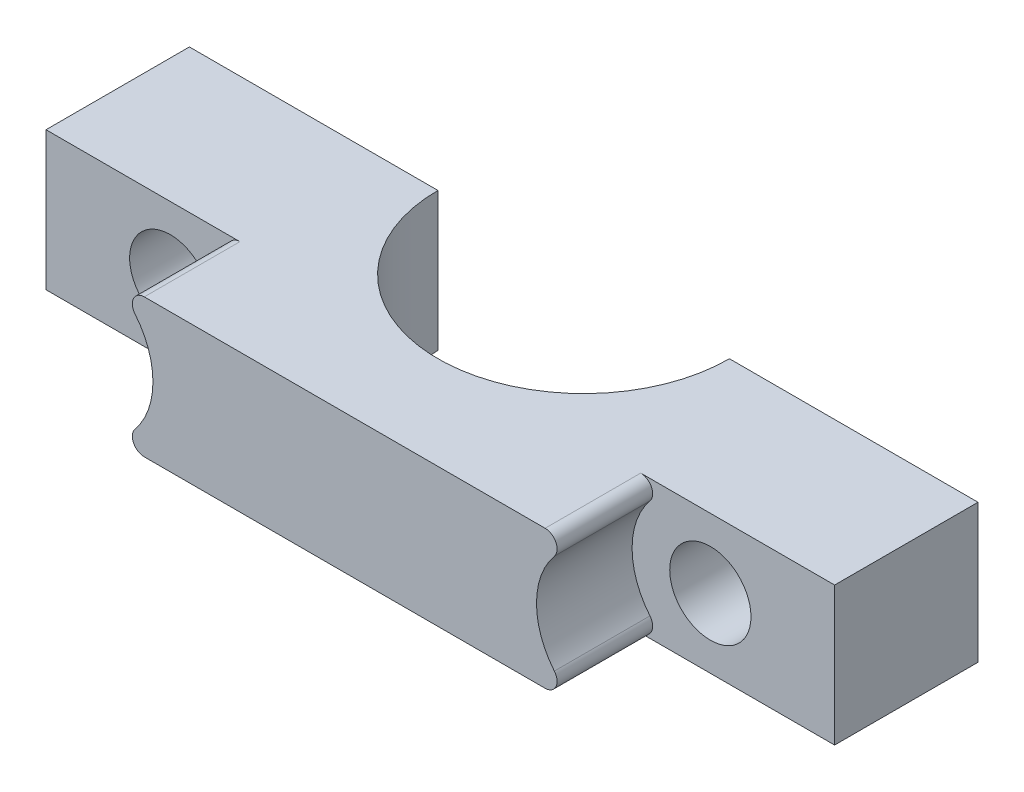
from build123d import *

# Parameters (mm, degrees)
BOSS_EXTRUDE1_DEPTH  = 5.8
M3_CLEARANCE_HOLE1_D = 3.4
CUT_EXTRUDE1_DEPTH   = 4
FILLET1_R            = 0.5


with BuildPart() as part:
    # Sketch1 → Boss-Extrude1 (new body)
    with BuildSketch(Plane(origin=(0, 0, 0), x_dir=(1, 0, 0), z_dir=(0, 1, 0))):
        with BuildLine():
            Line((-16.5, 0), (16.5, 0))
            Line((16.5, 0), (16.5, 10))
            Line((16.5, 10), (6.1, 10))
            ThreePointArc((6.1, 10), (0, 3.9), (-6.1, 10))
            Line((-6.1, 10), (-16.5, 10))
            Line((-16.5, 10), (-16.5, 0))
        make_face()
    extrude(amount=BOSS_EXTRUDE1_DEPTH)

    # M3 Clearance Hole1 (through all)
    with Locations(Plane.XY):
        with Locations((-11.3, 2.9), (11.3, 2.9)):
            Hole(M3_CLEARANCE_HOLE1_D / 2)

    # Sketch5 → Cut-Extrude1 (cut)
    with BuildSketch(Plane.XY):
        with BuildLine():
            Line((-9.778282221, 5.8), (-16.5, 5.8))
            Line((-16.5, 5.8), (-16.5, 0))
            Line((-16.5, 0), (-9.778282221, 0))
            ThreePointArc((-9.778282221, 0), (-8.025, 2.9), (-9.778282221, 5.8))
        make_face()
        with BuildLine():
            Line((16.5, 0), (9.778282221, 0))
            ThreePointArc((9.778282221, 0), (8.025, 2.9), (9.778282221, 5.8))
            Line((9.778282221, 5.8), (16.5, 5.8))
            Line((16.5, 5.8), (16.5, 0))
        make_face()
    extrude(amount=-CUT_EXTRUDE1_DEPTH, mode=Mode.SUBTRACT)

    # Fillet1
    fillet1_edges = [part.edges().sort_by_distance(p)[0] for p in [
        (-9.778282221, 5.8, -2),
        (-9.778282221, 0, -2),
        (9.778282221, 0, -2),
        (9.778282221, 5.8, -2),
    ]]
    fillet(fillet1_edges, radius=FILLET1_R)


solid = part.part
